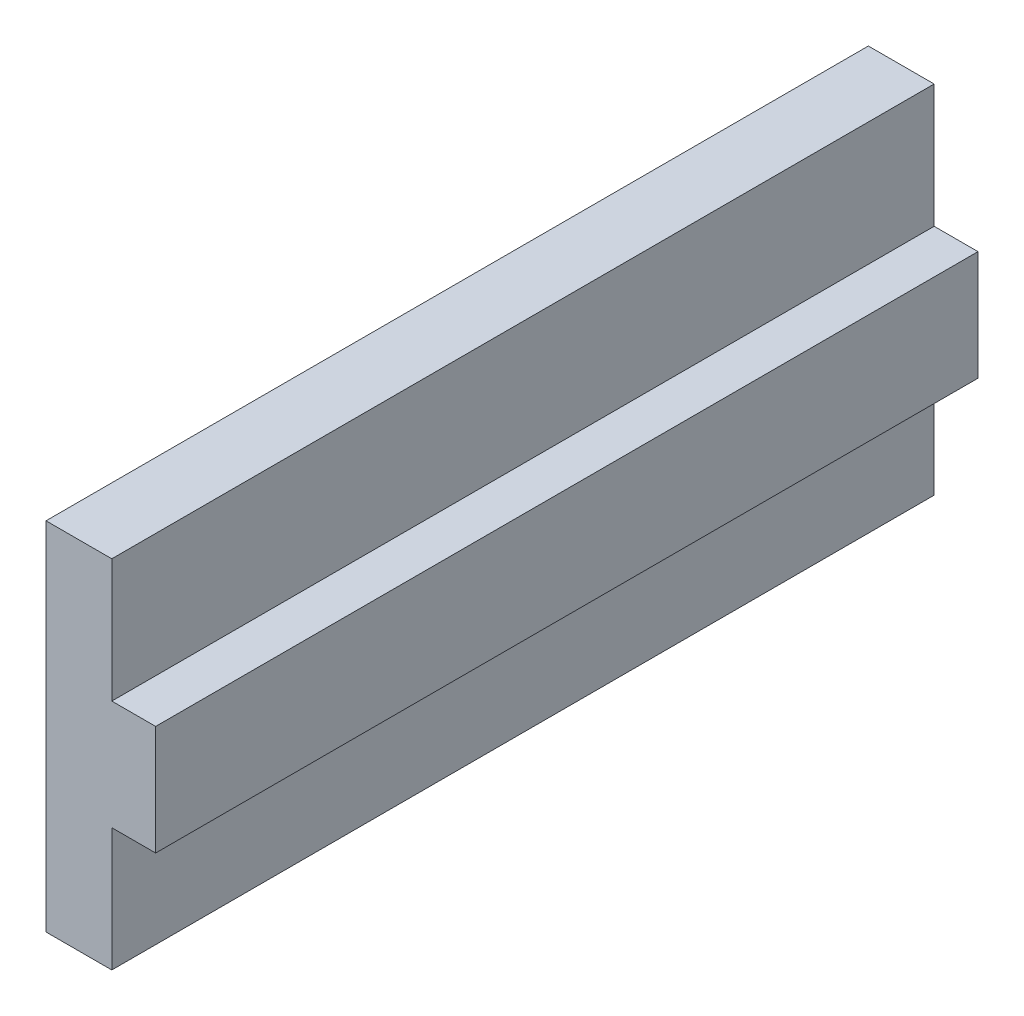
from build123d import *

# Parameters (mm, degrees)
BOSS_EXTRUDE1_DEPTH = 47.625


with BuildPart() as part:
    # Sketch1 → Boss-Extrude1 (new body)
    with BuildSketch(Plane.XY):
        Polygon((0, 0), (0, 20.6248), (3.81, 20.6248), (3.81, 13.4874), (6.35, 13.4874), (6.35, 7.1374), (3.81, 7.1374), (3.81, 0), align=None)
    extrude(amount=BOSS_EXTRUDE1_DEPTH)


solid = part.part
